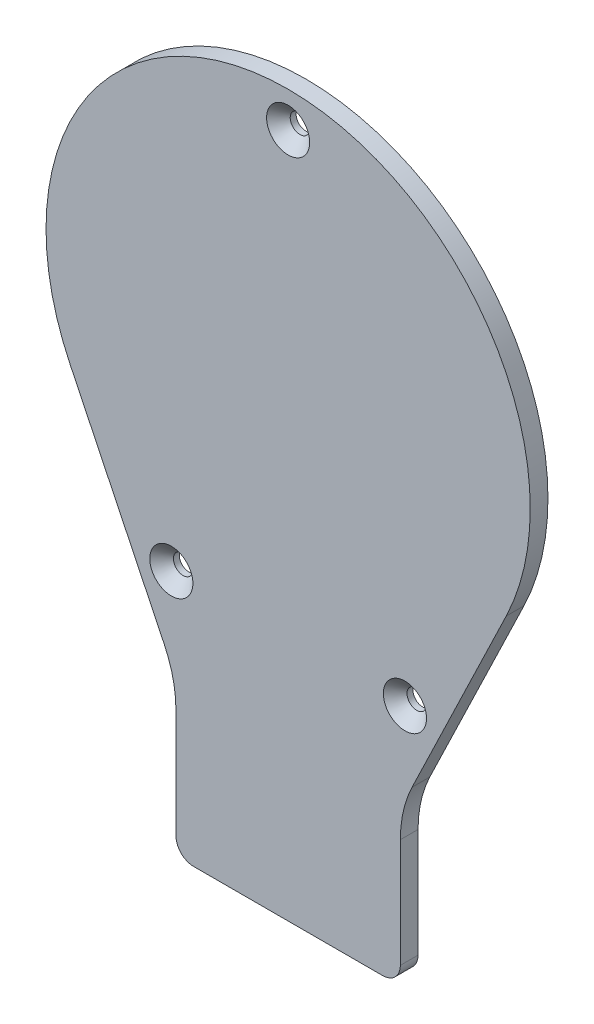
from build123d import *

# Parameters (mm, degrees)
ESQUISSE1_R        = 1.65
BOSS_EXTRU_1_DEPTH = 3
CHANFREIN1_SIZE    = 2


with BuildPart() as part:
    # Esquisse1 → Boss.-Extru.1 (new body)
    with BuildSketch(Plane.XY):
        with BuildLine():
            Line((-16, 0), (16, 0))
            ThreePointArc((16, 0), (18.121320344, 0.878679656), (19, 3))
            Line((19, 3), (19, 21.430548548))
            ThreePointArc((19, 21.430548548), (19.502411268, 25.885212805), (20.984403364, 30.11606971))
            Line((20.984403364, 30.11606971), (36.931973103, 63.194681617))
            ThreePointArc((36.931973103, 63.194681617), (0, 122), (-36.931973103, 63.194681617))
            Line((-36.931973103, 63.194681617), (-20.984403364, 30.11606971))
            ThreePointArc((-20.984403364, 30.11606971), (-19.502411268, 25.885212805), (-19, 21.430548548))
            Line((-19, 21.430548548), (-19, 3))
            ThreePointArc((-19, 3), (-18.121320344, 0.878679656), (-16, 0))
        make_face()
        with Locations((0, 116)):
            Circle(ESQUISSE1_R, mode=Mode.SUBTRACT)
        with Locations((19.780142429, 41.434276058)):
            Circle(ESQUISSE1_R, mode=Mode.SUBTRACT)
        with Locations((-19.780142429, 41.434276058)):
            Circle(ESQUISSE1_R, mode=Mode.SUBTRACT)
    extrude(amount=BOSS_EXTRU_1_DEPTH)

    # Chanfrein1
    chanfrein1_edges = [part.edges().sort_by_distance(p)[0] for p in [
        (-1.65, 116, 3),
        (18.130142429, 41.434276058, 3),
        (-21.430142429, 41.434276058, 3),
    ]]
    chamfer(chanfrein1_edges, length=CHANFREIN1_SIZE)


solid = part.part
